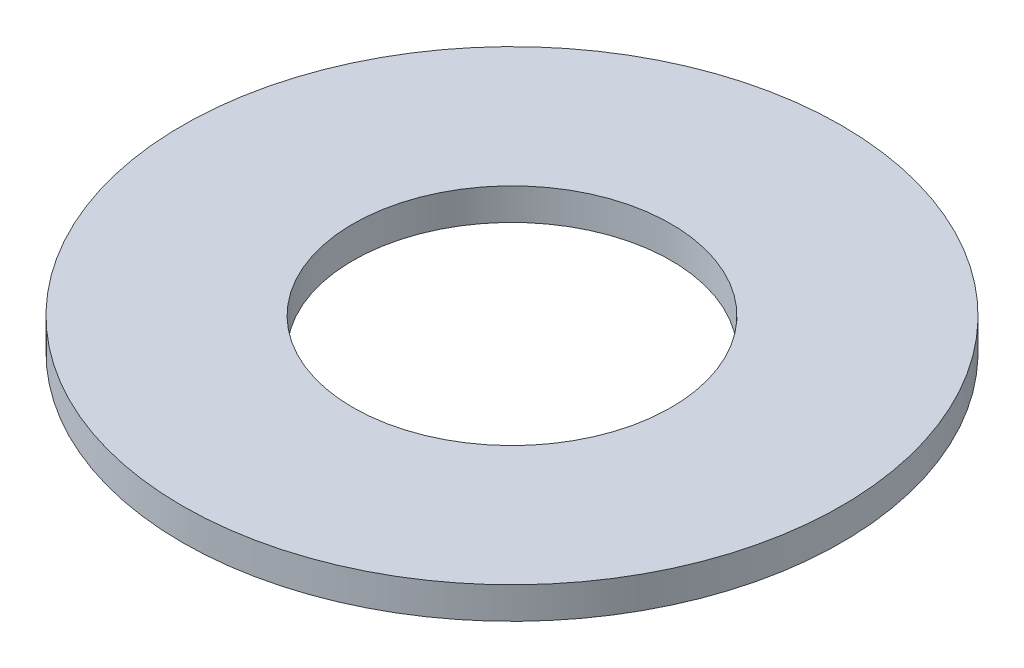
from build123d import *

# Parameters (mm, degrees)
SKETCH1_R           = 66.04
BOSS_EXTRUDE1_DEPTH = 6.35
SKETCH2_R           = 31.877
CUT_EXTRUDE1_DEPTH  = 6.35


with BuildPart() as part:
    # Sketch1 → Boss-Extrude1 (new body)
    with BuildSketch(Plane(origin=(0, 0, 0), x_dir=(1, 0, 0), z_dir=(0, 1, 0))):
        with Locations(Location((0, 0, 0), (0, 0, 270))):
            Circle(SKETCH1_R)
    extrude(amount=BOSS_EXTRUDE1_DEPTH)

    # Sketch2 → Cut-Extrude1 (cut)
    with BuildSketch(Plane(origin=(0, 6.35, 0), x_dir=(1, 0, 0), z_dir=(0, 1, 0))):
        with Locations(Location((0, 0, 0), (0, 0, 270))):
            Circle(SKETCH2_R)
    extrude(amount=-CUT_EXTRUDE1_DEPTH, mode=Mode.SUBTRACT)


solid = part.part
